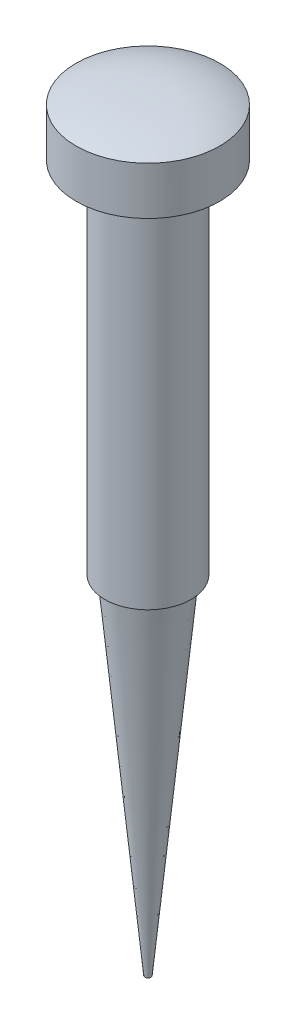
from build123d import *

# Parameters (mm, degrees)
SKETCH1_R           = 1.8
BOSS_EXTRUDE1_DEPTH = 15
SKETCH2_R           = 3
BOSS_EXTRUDE2_DEPTH = 2


with BuildPart() as part:
    # Sketch1 → Boss-Extrude1 (new body)
    with BuildSketch(Plane(origin=(0, 0, 0), x_dir=(1, 0, 0), z_dir=(0, 1, 0))):
        with Locations(Location((0, 0, 0), (0, 0, 270))):
            Circle(SKETCH1_R)
    extrude(amount=BOSS_EXTRUDE1_DEPTH)

    # Sketch2 → Boss-Extrude2 (add)
    with BuildSketch(Plane(origin=(0, 15, 0), x_dir=(1, 0, 0), z_dir=(0, 1, 0))):
        with Locations(Location((0, 0, 0), (0, 0, 270))):
            Circle(SKETCH2_R)
    extrude(amount=BOSS_EXTRUDE2_DEPTH)

    # Sketch3 → Revolve1 (revolve)
    with BuildSketch(Plane.XY):
        with BuildLine():
            Line((0, 17), (-3, 17))
            add(Edge.make_bspline(
                [(-3, 17), (-2.027477475, 17.462743373), (-0.971060037, 17.5), (0, 17.5)],
                knots=[0, 0, 0, 0, 1, 1, 1, 1], degree=3))
            Line((0, 17.5), (0, 17))
        make_face()
    revolve(axis=Axis((0, 17, 0), (0, 1, 0)))

    # Sketch4 → Revolve3 (revolve)
    with BuildSketch(Plane.XY, mode=Mode.PRIVATE) as revolve3_sk:
        Polygon((0, 0), (1.500760402, 0), (0.125, -14.5), (0, -14.5), align=None)
    revolve(revolve3_sk.sketch.rotate(Axis((0, 0, 0), (0, -1, 0)), 180), axis=Axis((0, 0, 0), (0, -1, 0)))


solid = part.part
